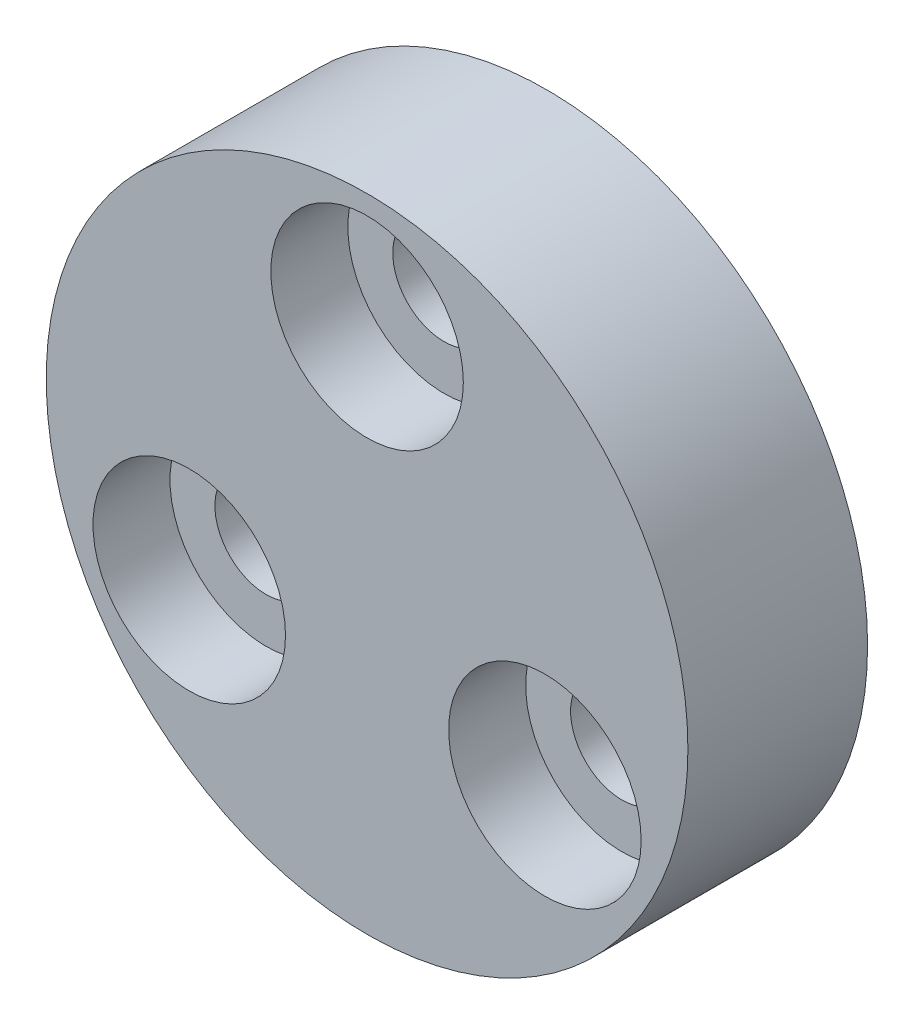
from build123d import *

# Parameters (mm, degrees)
SKETCH_1_R      = 12.5
SKETCH_1_R_2    = 2
EXTRUDE_1_DEPTH = 4
SKETCH_2_R      = 12.5
SKETCH_2_R_2    = 3.75
EXTRUDE_2_DEPTH = 3


with BuildPart() as part:
    # 草图1 → 凸台-拉伸1 (new body)
    with BuildSketch(Plane.XY):
        Circle(SKETCH_1_R)
        with Locations((0, 8)):
            Circle(SKETCH_1_R_2, mode=Mode.SUBTRACT)
        with Locations((6.92820323, -4)):
            Circle(SKETCH_1_R_2, mode=Mode.SUBTRACT)
        with Locations((-6.92820323, -4)):
            Circle(SKETCH_1_R_2, mode=Mode.SUBTRACT)
    extrude(amount=EXTRUDE_1_DEPTH)

    # 草图2 → 凸台-拉伸2 (add)
    with BuildSketch(Plane.XY.offset(4)):
        Circle(SKETCH_2_R)
        with Locations((0, 8)):
            Circle(SKETCH_2_R_2, mode=Mode.SUBTRACT)
        with Locations((6.92820323, -4)):
            Circle(SKETCH_2_R_2, mode=Mode.SUBTRACT)
        with Locations((-6.92820323, -4)):
            Circle(SKETCH_2_R_2, mode=Mode.SUBTRACT)
    extrude(amount=EXTRUDE_2_DEPTH)


solid = part.part
